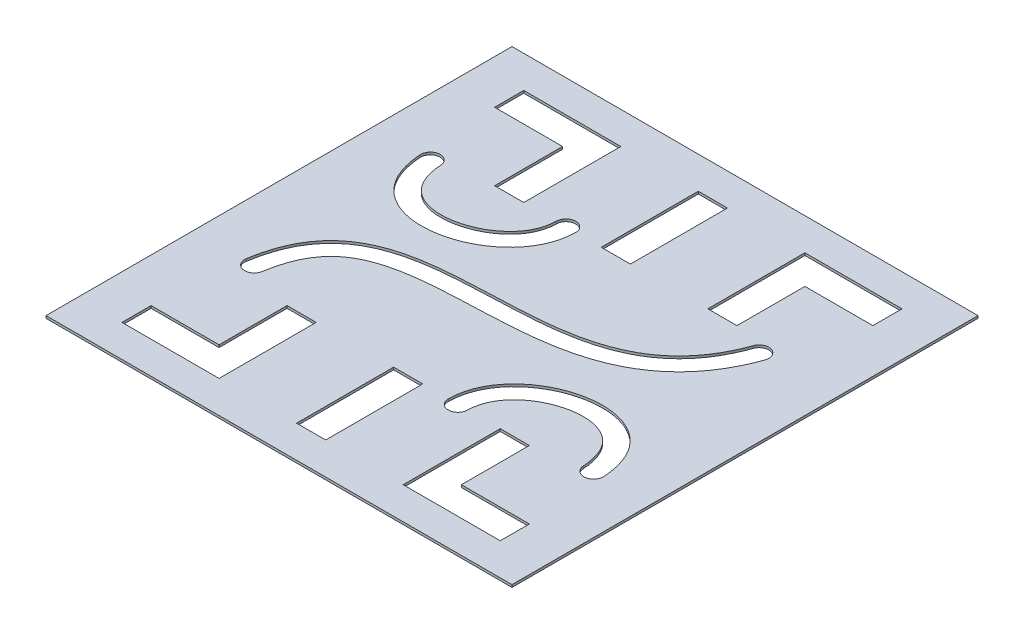
from build123d import *

# Parameters (mm, degrees)
SKETCH1_W           = 609.6
SKETCH1_H           = 609.6
SKETCH1_W_2         = 38.1
SKETCH1_H_2         = 127
BOSS_EXTRUDE1_DEPTH = 3.175


with BuildPart() as part:
    # Sketch1 → Boss-Extrude1 (new body)
    with BuildSketch(Plane(origin=(0, 0, 0), x_dir=(1, 0, 0), z_dir=(0, 1, 0))):
        Rectangle(SKETCH1_W, SKETCH1_H)
        Polygon((120.408154002, 135.779180095), (120.408154002, 262.779180095), (247.408154002, 262.779180095), (247.408154002, 224.679180095), (158.508154002, 224.679180095), (158.508154002, 135.779180095), align=None, mode=Mode.SUBTRACT)
        with Locations((0, 199.279180095)):
            Rectangle(SKETCH1_W_2, SKETCH1_H_2, mode=Mode.SUBTRACT)
        Polygon((-158.508154002, 224.679180095), (-158.508154002, 135.779180095), (-120.408154002, 135.779180095), (-120.408154002, 262.779180095), (-247.408154002, 262.779180095), (-247.408154002, 224.679180095), align=None, mode=Mode.SUBTRACT)
        Polygon((158.508154002, -224.679180095), (158.508154002, -135.779180095), (120.408154002, -135.779180095), (120.408154002, -262.779180095), (247.408154002, -262.779180095), (247.408154002, -224.679180095), align=None, mode=Mode.SUBTRACT)
        with Locations((0, -199.279180095)):
            Rectangle(SKETCH1_W_2, SKETCH1_H_2, mode=Mode.SUBTRACT)
        Polygon((-247.408154002, -224.679180095), (-158.508154002, -224.679180095), (-158.508154002, -135.779180095), (-120.408154002, -135.779180095), (-120.408154002, -262.779180095), (-247.408154002, -262.779180095), align=None, mode=Mode.SUBTRACT)
        with BuildLine():
            ThreePointArc((52.551332081, -135.779180095), (65.092340177, -148.636206032), (77.949366114, -136.095197937))
            add(Edge.make_bspline(
                [(77.949366114, -136.095197937), (77.962871775, -135.00976167), (78.051522279, -132.819994322), (78.461018982, -128.610747096), (79.391750695, -123.529893605), (81.140586923, -117.702146239), (84.288273438, -110.22828937), (89.724874356, -101.398698485), (98.52001314, -91.730852125), (109.296478393, -83.291620152), (125.7100411, -74.097744104), (144.107538407, -68.589807628), (162.008327299, -67.396780618), (174.562605493, -68.637977939), (185.730202076, -71.902172234), (195.230771881, -77.014054641), (201.820897642, -82.819870924), (206.398964756, -88.654208165), (209.481301131, -93.743351916), (212.177363153, -99.667795966), (214.042508359, -105.400408521), (215.255816836, -110.514072692), (216.01193439, -114.620965061), (216.502025281, -118.283361589), (216.801657973, -121.346084505), (216.920978677, -122.947020667), (216.971104363, -123.739711144)],
                knots=[0, 0, 0, 0, 0.015625, 0.03125, 0.0625, 0.09375, 0.125, 0.1875, 0.25, 0.3125, 0.375, 0.5, 0.5625, 0.625, 0.6875, 0.75, 0.8125, 0.84375, 0.875, 0.90625, 0.9375, 0.953125, 0.96875, 0.984375, 0.9921875, 1, 1, 1, 1], degree=3))
            ThreePointArc((216.971104363, -123.739711144), (230.447270979, -135.612913465), (242.3204733, -122.136746849))
            add(Edge.make_bspline(
                [(52.551332081, -135.779180095), (53.803993226, -35.104071896), (234.278707736, 5.036193149), (242.3204733, -122.136746849)],
                knots=[0, 0, 0, 0, 1, 1, 1, 1], degree=3))
        make_face(mode=Mode.SUBTRACT)
        with BuildLine():
            ThreePointArc((-52.551332081, 135.779180095), (-65.092340177, 148.636206032), (-77.949366114, 136.095197937))
            add(Edge.make_bspline(
                [(-77.949366114, 136.095197937), (-77.962871775, 135.00976167), (-78.051522279, 132.819994322), (-78.461018982, 128.610747096), (-79.391750695, 123.529893605), (-81.140586923, 117.702146239), (-84.288273438, 110.22828937), (-89.724874356, 101.398698485), (-98.52001314, 91.730852125), (-109.296478393, 83.291620152), (-125.7100411, 74.097744104), (-144.107538407, 68.589807628), (-162.008327299, 67.396780618), (-174.562605493, 68.637977939), (-185.730202076, 71.902172234), (-195.230771881, 77.014054641), (-201.820897642, 82.819870924), (-206.398964756, 88.654208165), (-209.481301131, 93.743351916), (-212.177363153, 99.667795966), (-214.042508359, 105.400408521), (-215.255816836, 110.514072692), (-216.01193439, 114.620965061), (-216.502025281, 118.283361589), (-216.801657973, 121.346084505), (-216.920978677, 122.947020667), (-216.971104363, 123.739711144)],
                knots=[0, 0, 0, 0, 0.015625, 0.03125, 0.0625, 0.09375, 0.125, 0.1875, 0.25, 0.3125, 0.375, 0.5, 0.5625, 0.625, 0.6875, 0.75, 0.8125, 0.84375, 0.875, 0.90625, 0.9375, 0.953125, 0.96875, 0.984375, 0.9921875, 1, 1, 1, 1], degree=3))
            ThreePointArc((-216.971104363, 123.739711144), (-230.447270979, 135.612913465), (-242.3204733, 122.136746849))
            add(Edge.make_bspline(
                [(-52.551332081, 135.779180095), (-53.803993226, 35.104071896), (-234.278707736, -5.036193149), (-242.3204733, 122.136746849)],
                knots=[0, 0, 0, 0, 1, 1, 1, 1], degree=3))
        make_face(mode=Mode.SUBTRACT)
        with BuildLine():
            ThreePointArc((-238.361805519, -109.276089344), (-227.793814923, -123.798402341), (-213.271501927, -113.230411744))
            add(Edge.make_bspline(
                [(-213.271501927, -113.230411744), (-213.151711371, -112.470336791), (-212.901399378, -110.942133808), (-212.376470719, -107.967853935), (-211.667401285, -104.350251745), (-210.737688056, -100.183113029), (-209.396326232, -94.848652891), (-207.537338772, -88.590365879), (-205.039618896, -81.703545889), (-202.297676371, -75.403179873), (-198.340291718, -67.72877181), (-192.86473475, -59.383344605), (-185.469393079, -50.978746481), (-177.159554076, -43.839947193), (-167.799053029, -37.731600761), (-153.784222926, -30.792133533), (-133.28509315, -24.22852654), (-104.453100091, -19.330230382), (-72.38586379, -16.682179087), (-38.055823436, -15.267140213), (-2.333026847, -13.913947785), (34.024700143, -11.346923243), (70.348040016, -6.174035434), (105.983184152, 3.16701171), (134.39986785, 15.91619513), (155.642723734, 29.956085882), (170.580590208, 42.556344707), (184.278786849, 57.320430485), (194.478117069, 71.453337622), (201.830548984, 83.861665804), (206.927792683, 93.718040184), (210.822379773, 102.401329596), (213.7158707, 109.613690679), (215.099625409, 113.341406131), (215.763927247, 115.202976942)],
                knots=[0, 0, 0, 0, 0.00390625, 0.0078125, 0.015625, 0.0234375, 0.03125, 0.046875, 0.0625, 0.078125, 0.09375, 0.125, 0.15625, 0.1875, 0.21875, 0.25, 0.3125, 0.375, 0.4375, 0.5, 0.5625, 0.625, 0.6875, 0.75, 0.8125, 0.84375, 0.875, 0.90625, 0.9375, 0.953125, 0.96875, 0.984375, 0.9921875, 1, 1, 1, 1], degree=3))
            ThreePointArc((215.763927247, 115.202976942), (208.071063547, 131.432574845), (191.841465644, 123.739711144))
            add(Edge.make_bspline(
                [(-238.361805519, -109.276089344), (-231.837247772, -67.877559295), (-143.94762142, 74.845593782), (129.599293897, -50.681317832), (191.841465644, 123.739711144)],
                knots=[0, 0, 0, 0, 0.18643952, 1, 1, 1, 1], degree=3))
        make_face(mode=Mode.SUBTRACT)
    extrude(amount=BOSS_EXTRUDE1_DEPTH)


solid = part.part
